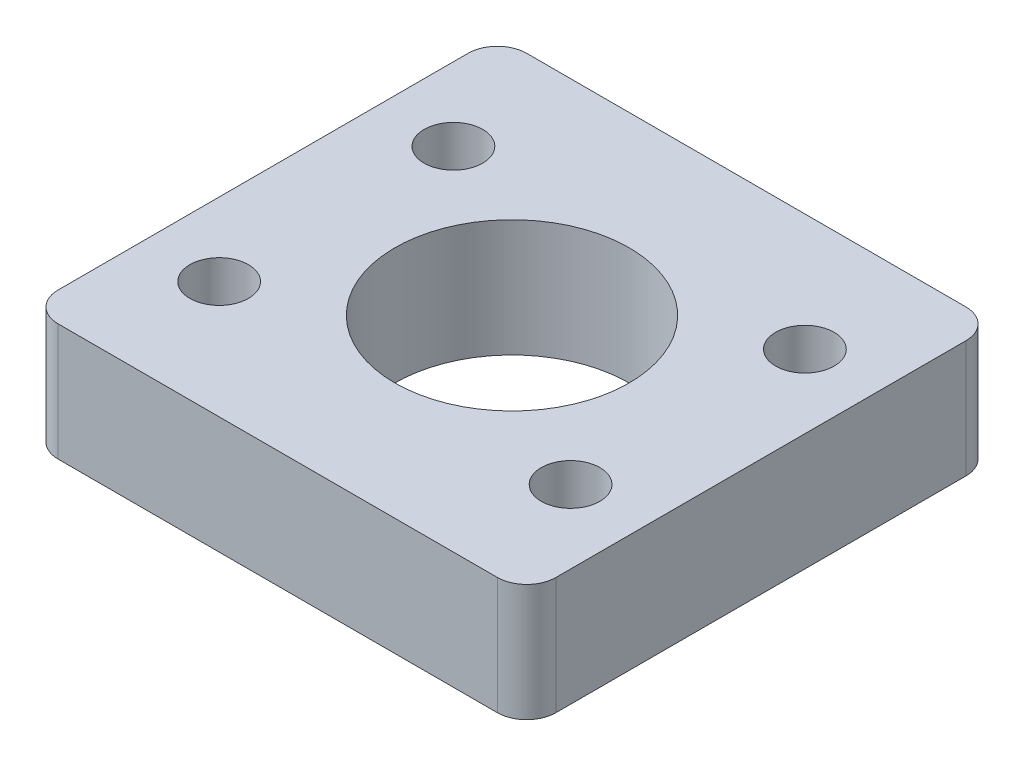
from build123d import *

# Parameters (mm, degrees)
SKETCH_1_W      = 17
SKETCH_1_H      = 16
SKETCH_1_R      = 1
SKETCH_1_R_2    = 4
EXTRUDE_1_DEPTH = 4
FILLET_1_R      = 1


with BuildPart() as part:
    # 草图1 → 凸台-拉伸1 (new body)
    with BuildSketch(Plane(origin=(0, 0, 0), x_dir=(1, 0, 0), z_dir=(0, 1, 0))):
        Rectangle(SKETCH_1_W, SKETCH_1_H)
        with Locations(Location((6, 4, 0), (0, 0, 270))):
            Circle(SKETCH_1_R, mode=Mode.SUBTRACT)
        with Locations(Location((-6, 4, 0), (0, 0, 90))):
            Circle(SKETCH_1_R, mode=Mode.SUBTRACT)
        with Locations(Location((6, -4, 0), (0, 0, 90))):
            Circle(SKETCH_1_R, mode=Mode.SUBTRACT)
        with Locations(Location((-6, -4, 0), (0, 0, 270))):
            Circle(SKETCH_1_R, mode=Mode.SUBTRACT)
        with Locations(Location((0, 0, 0), (0, 0, 270))):
            Circle(SKETCH_1_R_2, mode=Mode.SUBTRACT)
    extrude(amount=EXTRUDE_1_DEPTH)

    # 圆角1
    fillet_1_edges = [part.edges().sort_by_distance(p)[0] for p in [
        (8.5, 2, 8),
        (-8.5, 2, 8),
        (-8.5, 2, -8),
        (8.5, 2, -8),
    ]]
    fillet(fillet_1_edges, radius=FILLET_1_R)


solid = part.part
